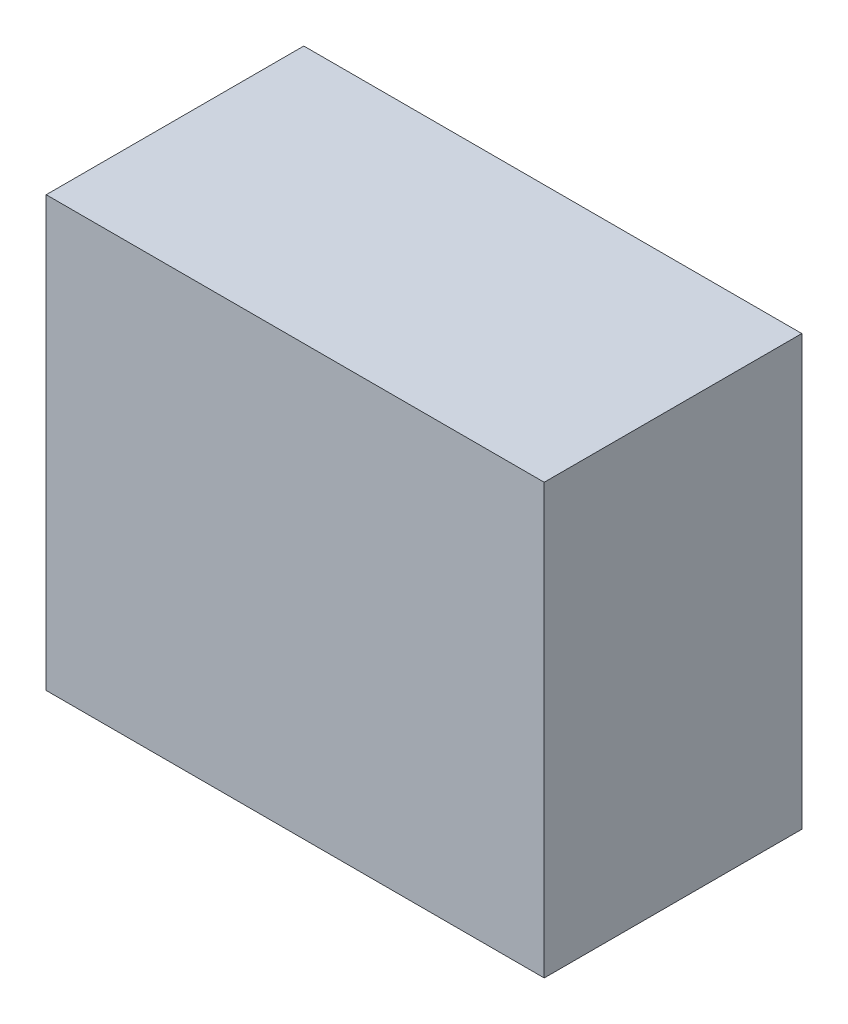
from build123d import *

# Parameters (mm, degrees)
SKETCH1_W           = 29.464
SKETCH1_H           = 25.4
BOSS_EXTRUDE1_DEPTH = 15.24
SKETCH2_W           = 20.1422
SKETCH2_H           = 11.43
CUT_EXTRUDE1_DEPTH  = 22.86


with BuildPart() as part:
    # Sketch1 → Boss-Extrude1 (new body)
    with BuildSketch(Plane.XY):
        with Locations((14.732, 12.7)):
            Rectangle(SKETCH1_W, SKETCH1_H)
    extrude(amount=BOSS_EXTRUDE1_DEPTH)

    # Sketch2 → Cut-Extrude1 (cut)
    with BuildSketch(Plane.XZ):
        with Locations((14.6939, 7.62)):
            Rectangle(SKETCH2_W, SKETCH2_H)
    extrude(amount=-CUT_EXTRUDE1_DEPTH, mode=Mode.SUBTRACT)


solid = part.part
